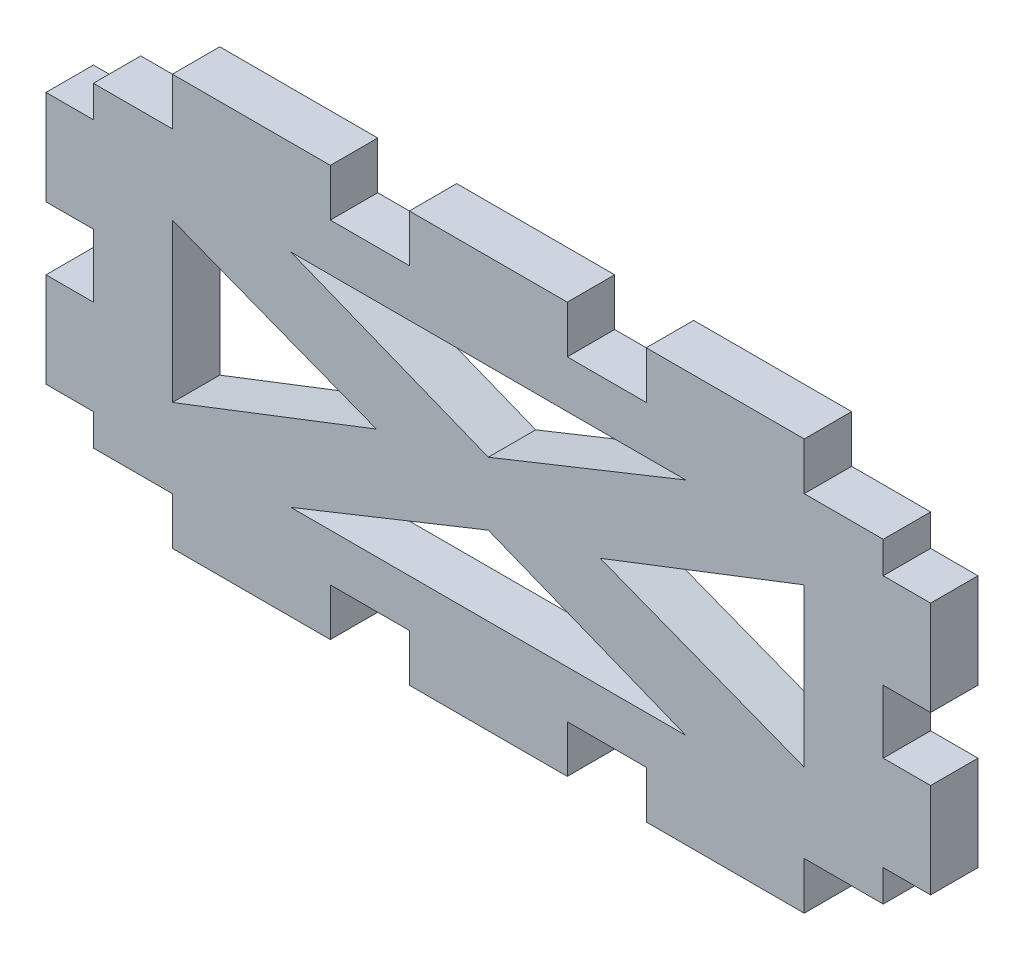
from build123d import *

# Parameters (mm, degrees)
EXTRUDE_1_DEPTH = 3


with BuildPart() as part:
    # 草图1 → 凸台-拉伸1 (new body)
    with BuildSketch(Plane.XY):
        Polygon((-25, -10), (-20, -10), (-20, -13), (-10, -13), (-10, -10), (-5, -10), (-5, -13), (5, -13), (5, -10), (10, -10), (10, -13), (20, -13), (20, -10), (25, -10), (25, -8), (28, -8), (28, -2), (25, -2), (25, 2), (28, 2), (28, 8), (25, 8), (25, 10), (20, 10), (20, 13), (10, 13), (10, 10), (5, 10), (5, 13), (-5, 13), (-5, 10), (-10, 10), (-10, 13), (-20, 13), (-20, 10), (-25, 10), (-25, 8), (-28, 8), (-28, 2), (-25, 2), (-25, -2), (-28, -2), (-28, -8), (-25, -8), align=None)
        Polygon((-12.5, 7), (12.5, 7), (0, 2), align=None, mode=Mode.SUBTRACT)
        Polygon((20, 5), (20, -5), (7.08425002, 0), align=None, mode=Mode.SUBTRACT)
        Polygon((-20, 5), (-7.08425002, 0), (-20, -5), align=None, mode=Mode.SUBTRACT)
        Polygon((-12.5, -7), (0, -2), (12.5, -7), align=None, mode=Mode.SUBTRACT)
    extrude(amount=EXTRUDE_1_DEPTH)


solid = part.part
